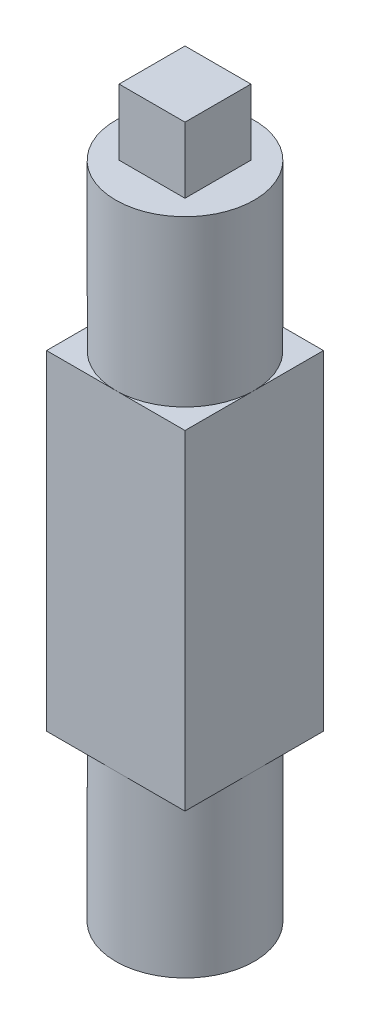
from build123d import *

# Parameters (mm, degrees)
SKETCH2_R           = 10.5
BOSS_EXTRUDE1_DEPTH = 25
SKETCH3_W           = 21
SKETCH3_H           = 21
BOSS_EXTRUDE2_DEPTH = 50
SKETCH4_R           = 10.5
BOSS_EXTRUDE3_DEPTH = 25
SKETCH5_W           = 10
SKETCH5_H           = 10
BOSS_EXTRUDE4_DEPTH = 10
SKETCH6_R           = 4
CUT_EXTRUDE1_DEPTH  = 18
SKETCH7_R           = 6.5
CUT_EXTRUDE2_DEPTH  = 65


with BuildPart() as part:
    # Sketch2 → Boss-Extrude1 (new body)
    with BuildSketch(Plane(origin=(0, 0, 0), x_dir=(1, 0, 0), z_dir=(0, 1, 0))):
        with Locations(Location((0, 0, 0), (0, 0, 270))):
            Circle(SKETCH2_R)
    extrude(amount=BOSS_EXTRUDE1_DEPTH)

    # Sketch3 → Boss-Extrude2 (add)
    with BuildSketch(Plane(origin=(0, 25, 0), x_dir=(1, 0, 0), z_dir=(0, 1, 0))):
        Rectangle(SKETCH3_W, SKETCH3_H)
    extrude(amount=BOSS_EXTRUDE2_DEPTH)

    # Sketch4 → Boss-Extrude3 (add)
    with BuildSketch(Plane(origin=(0, 75, 0), x_dir=(1, 0, 0), z_dir=(0, 1, 0))):
        with Locations(Location((0, 0, 0), (0, 0, 270))):
            Circle(SKETCH4_R)
    extrude(amount=BOSS_EXTRUDE3_DEPTH)

    # Sketch5 → Boss-Extrude4 (add)
    with BuildSketch(Plane(origin=(0, 100, 0), x_dir=(1, 0, 0), z_dir=(0, 1, 0))):
        Rectangle(SKETCH5_W, SKETCH5_H)
    extrude(amount=BOSS_EXTRUDE4_DEPTH)

    # Sketch6 → Cut-Extrude1 (cut)
    with BuildSketch(Plane.ZY.offset(10.5)):
        with Locations((0, 56.203092856)):
            Circle(SKETCH6_R)
    extrude(amount=-CUT_EXTRUDE1_DEPTH, mode=Mode.SUBTRACT)

    # Sketch7 → Cut-Extrude2 (cut)
    with BuildSketch(Plane.XZ):
        with Locations(Location((0, 0, 0), (0, 0, 270))):
            Circle(SKETCH7_R)
    extrude(amount=-CUT_EXTRUDE2_DEPTH, mode=Mode.SUBTRACT)


solid = part.part
